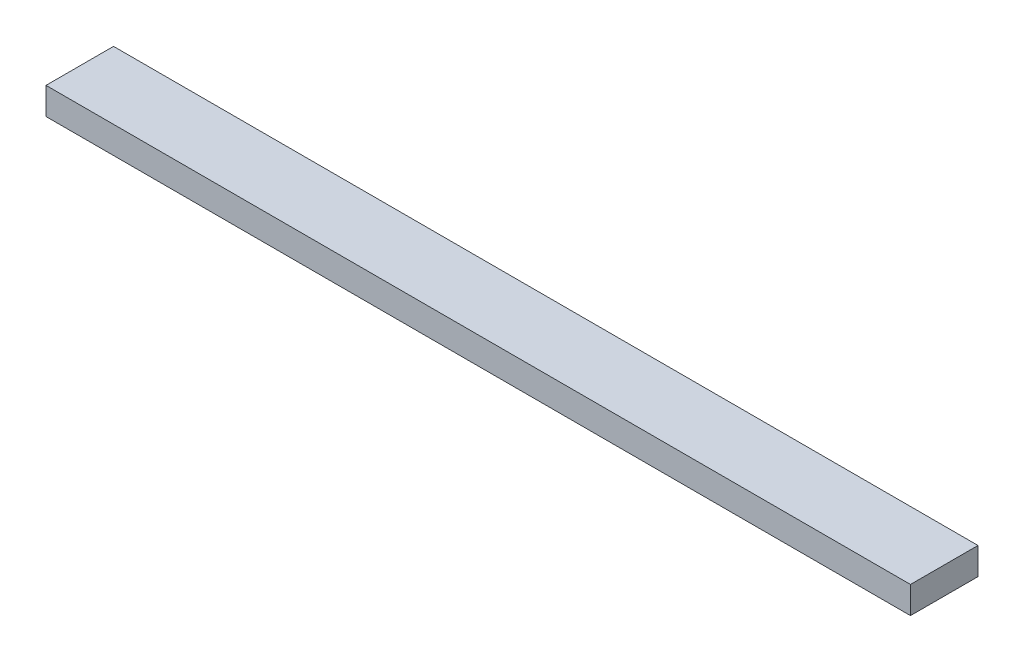
from build123d import *

# Parameters (mm, degrees)
SKETCH1_W           = 320
SKETCH1_H           = 25
BOSS_EXTRUDE1_DEPTH = 10


with BuildPart() as part:
    # Sketch1 → Boss-Extrude1 (new body)
    with BuildSketch(Plane(origin=(0, 0, 0), x_dir=(1, 0, 0), z_dir=(0, 1, 0))):
        with Locations((160, 12.5)):
            Rectangle(SKETCH1_W, SKETCH1_H)
    extrude(amount=BOSS_EXTRUDE1_DEPTH)


solid = part.part
